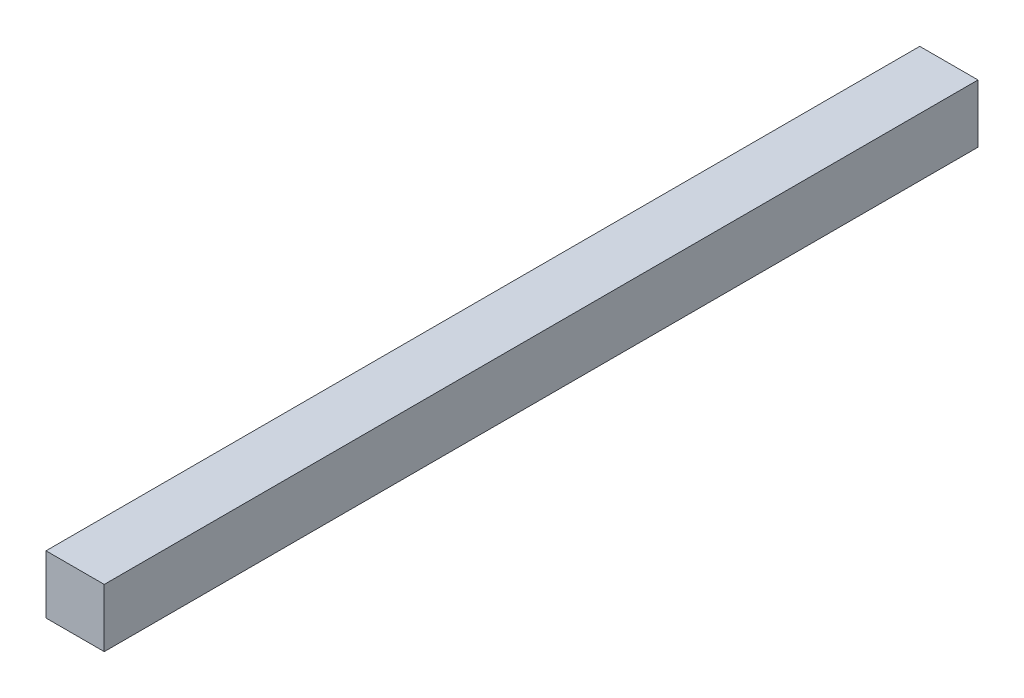
from build123d import *

# Parameters (mm, degrees)
SKETCH2_W           = 100
SKETCH2_H           = 100
BOSS_EXTRUDE1_DEPTH = 1500


with BuildPart() as part:
    # Sketch2 → Boss-Extrude1 (new body)
    with BuildSketch(Plane.XY):
        with Locations((50, 50)):
            Rectangle(SKETCH2_W, SKETCH2_H)
    extrude(amount=BOSS_EXTRUDE1_DEPTH)


solid = part.part
